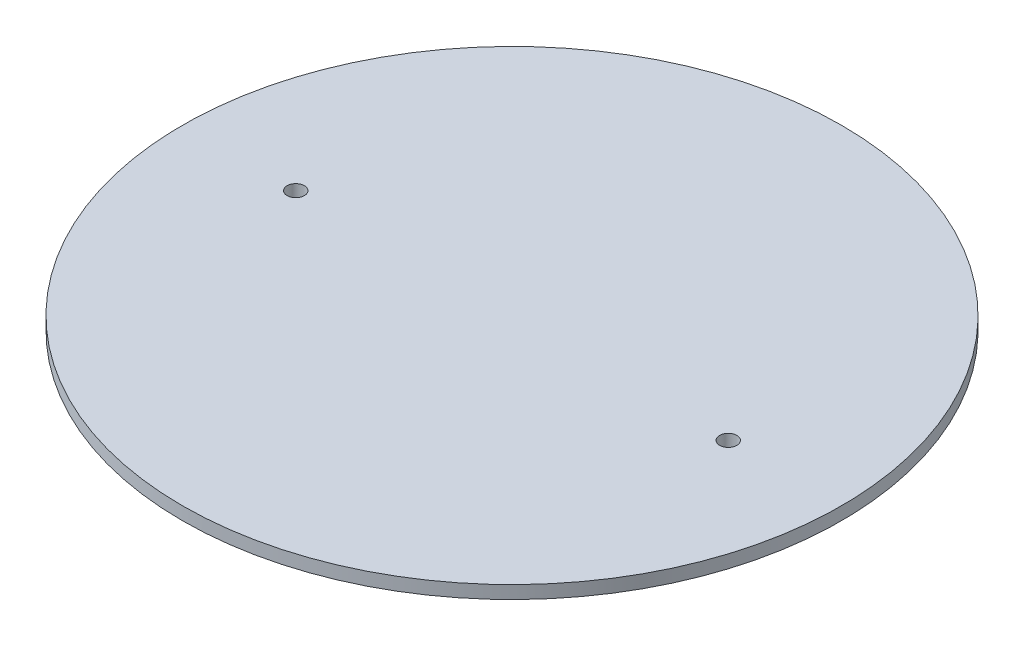
from build123d import *

# Parameters (mm, degrees)
BOSS_EXTRUDE1_DEPTH      = 1.5
BOSS_EXTRUDE1_DEPTH_BACK = 1.5
SKETCH1_R                = 76.2
SKETCH1_R_2              = 2


with BuildPart() as part:
    # Sketch1 → Boss-Extrude1 (new, two sides: drawn at the far end of the back side and taken through both)
    with BuildSketch(Plane(origin=(0, 0, 0), x_dir=(1, 0, 0), z_dir=(0, 1, 0)).offset(-BOSS_EXTRUDE1_DEPTH_BACK)):
        Circle(SKETCH1_R)
        with Locations((-50, 0)):
            Circle(SKETCH1_R_2, mode=Mode.SUBTRACT)
        with Locations((50, 0)):
            Circle(SKETCH1_R_2, mode=Mode.SUBTRACT)
    extrude(amount=BOSS_EXTRUDE1_DEPTH + BOSS_EXTRUDE1_DEPTH_BACK)


solid = part.part
